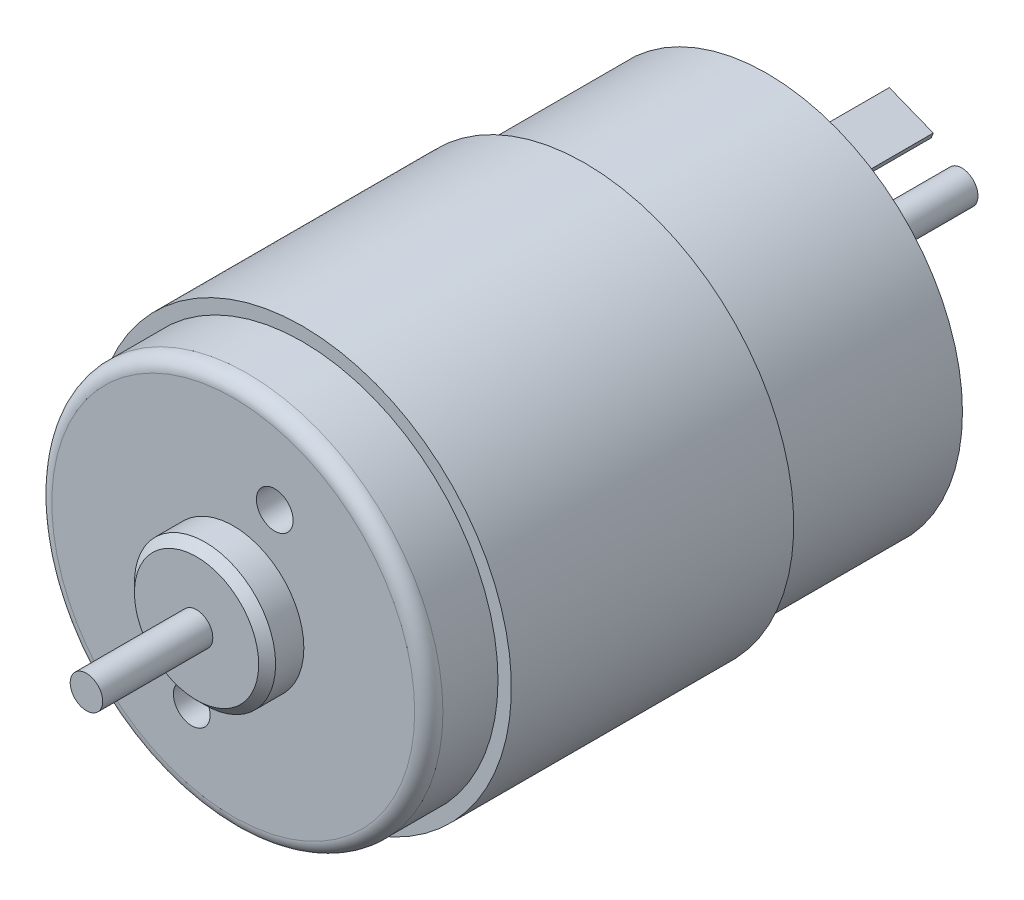
from build123d import *

# Parameters (mm, degrees)
SKETCH1_W                      = 14.8
SKETCH1_H                      = 20
SKETCH2_R                      = 13.85
BOSS_EXTRUDE1_DEPTH            = 12.9
BOSS_EXTRUDE2_DEPTH            = 6
BOSS_EXTRUDE3_DEPTH            = 6
BOSS_EXTRUDE4_START            = 4.9
SKETCH5_R                      = 13.85
BOSS_EXTRUDE4_DEPTH            = 4.9
SKETCH6_R                      = 5
BOSS_EXTRUDE5_DEPTH            = 2.6
SKETCH7_R                      = 1.15
BOSS_EXTRUDE6_DEPTH            = 7.8
BOSS_EXTRUDE7_START            = 2.6
SKETCH8_R                      = 5
BOSS_EXTRUDE7_DEPTH            = 2.6
BOSS_EXTRUDE8_START            = 11.2
SKETCH9_R                      = 1.15
BOSS_EXTRUDE8_DEPTH            = 11.2
F_2_6_2_6_DIAMETER_HOLE1_D     = 2.6
F_2_6_2_6_DIAMETER_HOLE1_DEPTH = 3.216319987
CHAMFER1_SIZE                  = 0.6
FILLET1_R                      = 1


with BuildPart() as part:
    # Sketch1 → Revolve1 (revolve)
    with BuildSketch(Plane.XZ, mode=Mode.PRIVATE) as revolve1_sk:
        with Locations((7.4, 22.9)):
            Rectangle(SKETCH1_W, SKETCH1_H)
    revolve(revolve1_sk.sketch.rotate(Axis((0, 0, 32.9), (0, 0, -1)), 270), axis=Axis((0, 0, 32.9), (0, 0, -1)))

    # Sketch2 → Boss-Extrude1 (add)
    with BuildSketch(Plane(origin=(0, 0, 12.9), x_dir=(-1, 0, 0), z_dir=(0, 0, -1))):
        with Locations(Location((0, 0, 0), (0, 0, 270))):
            Circle(SKETCH2_R)
    extrude(amount=BOSS_EXTRUDE1_DEPTH)

    # Sketch3 → Boss-Extrude2 (add)
    with BuildSketch(Plane(origin=(0, 0, 0), x_dir=(-1, 0, 0), z_dir=(0, 0, -1))):
        Polygon((-5.782608477, 10.080528964), (-2.666854949, 11.311211681), (-2.519907759, 10.939181409), (-5.635661287, 9.708498692), align=None)
    extrude(amount=BOSS_EXTRUDE2_DEPTH)

    # Sketch4 → Boss-Extrude3 (add)
    with BuildSketch(Plane(origin=(0, 0, 0), x_dir=(-1, 0, 0), z_dir=(0, 0, -1))):
        Polygon((2.519907759, -10.939181409), (5.635661287, -9.708498692), (5.782608477, -10.080528964), (2.666854949, -11.311211681), align=None)
    extrude(amount=BOSS_EXTRUDE3_DEPTH)

    # Sketch5 → Boss-Extrude4 (add)
    with BuildSketch(Plane.XY.offset(32.9).offset(BOSS_EXTRUDE4_START)):
        with Locations(Location((0, 0, 0), (0, 0, 270))):
            Circle(SKETCH5_R)
    extrude(amount=-BOSS_EXTRUDE4_DEPTH)

    # Sketch6 → Boss-Extrude5 (add)
    with BuildSketch(Plane.XY.offset(37.8)):
        Circle(SKETCH6_R)
    extrude(amount=BOSS_EXTRUDE5_DEPTH)

    # Sketch7 → Boss-Extrude6 (add)
    with BuildSketch(Plane.XY.offset(40.4)):
        Circle(SKETCH7_R)
    extrude(amount=BOSS_EXTRUDE6_DEPTH)

    # Sketch8 → Boss-Extrude7 (add)
    with BuildSketch(Plane(origin=(0, 0, 0), x_dir=(-1, 0, 0), z_dir=(0, 0, -1)).offset(BOSS_EXTRUDE7_START)):
        with Locations(Location((0, 0, 0), (0, 0, 180))):
            Circle(SKETCH8_R)
    extrude(amount=-BOSS_EXTRUDE7_DEPTH)

    # Sketch9 → Boss-Extrude8 (add)
    with BuildSketch(Plane(origin=(0, 0, -2.6), x_dir=(-1, 0, 0), z_dir=(0, 0, -1)).offset(BOSS_EXTRUDE8_START)):
        with Locations(Location((0, 0, 0), (0, 0, 180))):
            Circle(SKETCH9_R)
    extrude(amount=-BOSS_EXTRUDE8_DEPTH)

    # Ø2.6 (2.6) Diameter Hole1
    with Locations(Plane.XY.offset(37.8)):
        with Locations((-2.9389438, -7.440605442), (2.9389438, 7.440605442)):
            Hole(F_2_6_2_6_DIAMETER_HOLE1_D / 2, depth=F_2_6_2_6_DIAMETER_HOLE1_DEPTH)

    # Chamfer1
    chamfer1_edges = [part.edges().sort_by_distance(p)[0] for p in [
        (-5, 0, 40.4),
        (-5, 0, -2.6),
    ]]
    chamfer(chamfer1_edges, length=CHAMFER1_SIZE)

    # Fillet1
    fillet1_edges = [part.edges().sort_by_distance(p)[0] for p in [
        (0, 13.85, 37.8),
    ]]
    fillet(fillet1_edges, radius=FILLET1_R)


solid = part.part
